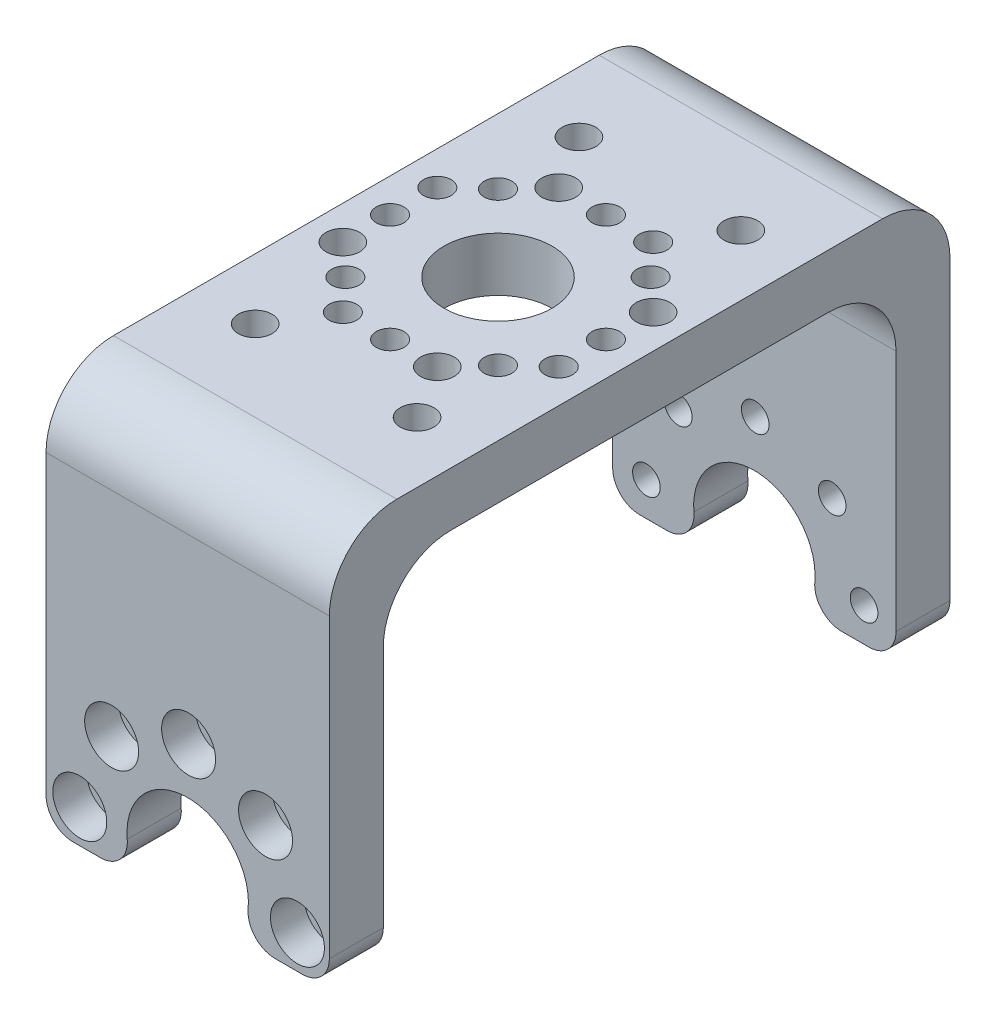
from build123d import *

# Parameters (mm, degrees)
SKETCH4_W           = 21
SKETCH4_H           = 4
BOSS_EXTRUDE3_DEPTH = 19
SKETCH3_R           = 1.025
BOSS_EXTRUDE2_DEPTH = 4
SKETCH7_R           = 2
CUT_EXTRUDE2_DEPTH  = 2.5
SKETCH6_R           = 4
CUT_EXTRUDE1_DEPTH  = 39.474017206
FILLET2_R           = 5
FILLET3_R           = 5
FILLET4_R           = 2


with BuildPart() as part:
    # Sketch4 → Boss-Extrude3 (new, symmetric)
    with BuildSketch(Plane.XY):
        Rectangle(SKETCH4_W, SKETCH4_H)
    extrude(amount=BOSS_EXTRUDE3_DEPTH, both=True)

    # Sketch3 → Boss-Extrude2 (add)
    with BuildSketch(Plane.XY.offset(19)):
        with BuildLine():
            Line((10.5, -27), (10.5, 2))
            Line((10.5, 2), (-10.5, 2))
            Line((-10.5, 2), (-10.5, -27))
            Line((-10.5, -27), (-3.676525192, -27))
            ThreePointArc((-3.676525192, -27), (-3.995419387, -22.334749823), (0, -19.905166188))
            ThreePointArc((0, -19.905166188), (3.995419387, -22.334749823), (3.676525192, -27))
            Line((3.676525192, -27), (10.5, -27))
        make_face()
        with Locations((-7.999402765, -24.502917938)):
            Circle(SKETCH3_R, mode=Mode.SUBTRACT)
        with Locations((-5.636784611, -18.799053148)):
            Circle(SKETCH3_R, mode=Mode.SUBTRACT)
        with Locations((8.133563123, -24.502917938)):
            Circle(SKETCH3_R, mode=Mode.SUBTRACT)
        with Locations((0.067080179, -16.436434994)):
            Circle(SKETCH3_R, mode=Mode.SUBTRACT)
        with Locations((5.770944969, -18.799053148)):
            Circle(SKETCH3_R, mode=Mode.SUBTRACT)
    boss_extrude2 = extrude(amount=BOSS_EXTRUDE2_DEPTH)

    # Sketch7 → Cut-Extrude2 (cut)
    with BuildSketch(Plane.XY.offset(23)):
        with Locations((-7.999402765, -24.502917938)):
            Circle(SKETCH7_R)
        with Locations((-5.636784611, -18.799053148)):
            Circle(SKETCH7_R)
        with Locations((0.067080179, -16.436434994)):
            Circle(SKETCH7_R)
        with Locations((5.770944969, -18.799053148)):
            Circle(SKETCH7_R)
        with Locations((8.133563123, -24.502917938)):
            Circle(SKETCH7_R)
    cut_extrude2 = extrude(amount=-CUT_EXTRUDE2_DEPTH, mode=Mode.SUBTRACT)

    # Mirror1: Boss-Extrude2, Cut-Extrude2 across plane
    add(boss_extrude2.mirror(Plane.XY))
    add(cut_extrude2.mirror(Plane.XY), mode=Mode.SUBTRACT)

    # Sketch6 → Cut-Extrude1 (cut, through all)
    with BuildSketch(Plane(origin=(0, 2, 0), x_dir=(1, 0, 0), z_dir=(0, 1, 0))):
        with Locations(Location((0, 0, 0), (0, 0, 270))):
            Circle(SKETCH6_R)
        with BuildLine():
            ThreePointArc((0, 9.025), (-1.025, 8), (0, 6.975))
            ThreePointArc((0, 6.975), (1.025, 8), (0, 9.025))
        make_face()
        with BuildLine():
            ThreePointArc((-6, 10.75), (-4.75, 12), (-6, 13.25))
            ThreePointArc((-6, 13.25), (-7.25, 12), (-6, 10.75))
        make_face()
        with BuildLine():
            ThreePointArc((-2.25, 8), (-3.5, 9.25), (-4.75, 8))
            ThreePointArc((-4.75, 8), (-3.5, 6.75), (-2.25, 8))
        make_face()
        with BuildLine():
            ThreePointArc((-5.656854249, 4.631854249), (-4.631854249, 5.656854249), (-5.656854249, 6.681854249))
            ThreePointArc((-5.656854249, 6.681854249), (-6.681854249, 5.656854249), (-5.656854249, 4.631854249))
        make_face()
        with BuildLine():
            ThreePointArc((-8, 2.475), (-6.975, 3.5), (-8, 4.525))
            ThreePointArc((-8, 4.525), (-9.025, 3.5), (-8, 2.475))
        make_face()
        with BuildLine():
            ThreePointArc((-2.475, -8), (-3.5, -6.975), (-4.525, -8))
            ThreePointArc((-4.525, -8), (-3.5, -9.025), (-2.475, -8))
        make_face()
        with BuildLine():
            ThreePointArc((0, -6.975), (-1.025, -8), (0, -9.025))
            ThreePointArc((0, -9.025), (1.025, -8), (0, -6.975))
        make_face()
        with BuildLine():
            ThreePointArc((-8, -1.025), (-6.975, 0), (-8, 1.025))
            ThreePointArc((-8, 1.025), (-9.025, 0), (-8, -1.025))
        make_face()
        with BuildLine():
            ThreePointArc((-8, -4.75), (-6.75, -3.5), (-8, -2.25))
            ThreePointArc((-8, -2.25), (-9.25, -3.5), (-8, -4.75))
        make_face()
        with BuildLine():
            ThreePointArc((-5.656854249, -6.681854249), (-4.631854249, -5.656854249), (-5.656854249, -4.631854249))
            ThreePointArc((-5.656854249, -4.631854249), (-6.681854249, -5.656854249), (-5.656854249, -6.681854249))
        make_face()
        with BuildLine():
            ThreePointArc((-6, -13.25), (-4.75, -12), (-6, -10.75))
            ThreePointArc((-6, -10.75), (-7.25, -12), (-6, -13.25))
        make_face()
        with BuildLine():
            ThreePointArc((6, 13.25), (4.75, 12), (6, 10.75))
            ThreePointArc((6, 10.75), (7.25, 12), (6, 13.25))
        make_face()
        with BuildLine():
            ThreePointArc((2.475, 8), (3.5, 6.975), (4.525, 8))
            ThreePointArc((4.525, 8), (3.5, 9.025), (2.475, 8))
        make_face()
        with BuildLine():
            ThreePointArc((5.656854249, 4.631854249), (6.681854249, 5.656854249), (5.656854249, 6.681854249))
            ThreePointArc((5.656854249, 6.681854249), (4.631854249, 5.656854249), (5.656854249, 4.631854249))
        make_face()
        with BuildLine():
            ThreePointArc((8, 2.25), (9.25, 3.5), (8, 4.75))
            ThreePointArc((8, 4.75), (6.75, 3.5), (8, 2.25))
        make_face()
        with BuildLine():
            ThreePointArc((8, -1.025), (9.025, 0), (8, 1.025))
            ThreePointArc((8, 1.025), (6.975, 0), (8, -1.025))
        make_face()
        with BuildLine():
            ThreePointArc((8, -4.525), (9.025, -3.5), (8, -2.475))
            ThreePointArc((8, -2.475), (6.975, -3.5), (8, -4.525))
        make_face()
        with BuildLine():
            ThreePointArc((5.656854249, -6.681854249), (6.681854249, -5.656854249), (5.656854249, -4.631854249))
            ThreePointArc((5.656854249, -4.631854249), (4.631854249, -5.656854249), (5.656854249, -6.681854249))
        make_face()
        with BuildLine():
            ThreePointArc((2.25, -8), (3.5, -9.25), (4.75, -8))
            ThreePointArc((4.75, -8), (3.5, -6.75), (2.25, -8))
        make_face()
        with BuildLine():
            ThreePointArc((6, -13.25), (7.25, -12), (6, -10.75))
            ThreePointArc((6, -10.75), (4.75, -12), (6, -13.25))
        make_face()
    extrude(amount=-CUT_EXTRUDE1_DEPTH, mode=Mode.SUBTRACT)

    # Fillet2
    fillet2_edges = [part.edges().sort_by_distance(p)[0] for p in [
        (0, -2, 19),
        (0, -2, -19),
    ]]
    fillet(fillet2_edges, radius=FILLET2_R)

    # Fillet3
    fillet3_edges = [part.edges().sort_by_distance(p)[0] for p in [
        (0, 2, 23),
        (0, 2, -23),
    ]]
    fillet(fillet3_edges, radius=FILLET3_R)

    # Fillet4
    fillet4_edges = [part.edges().sort_by_distance(p)[0] for p in [
        (-10.5, -27, 21),
        (-3.676525192, -27, 21),
        (3.676525192, -27, 21),
        (10.5, -27, 21),
        (-3.676525192, -27, -21),
        (-10.5, -27, -21),
        (10.5, -27, -21),
        (3.676525192, -27, -21),
    ]]
    fillet(fillet4_edges, radius=FILLET4_R)


solid = part.part
